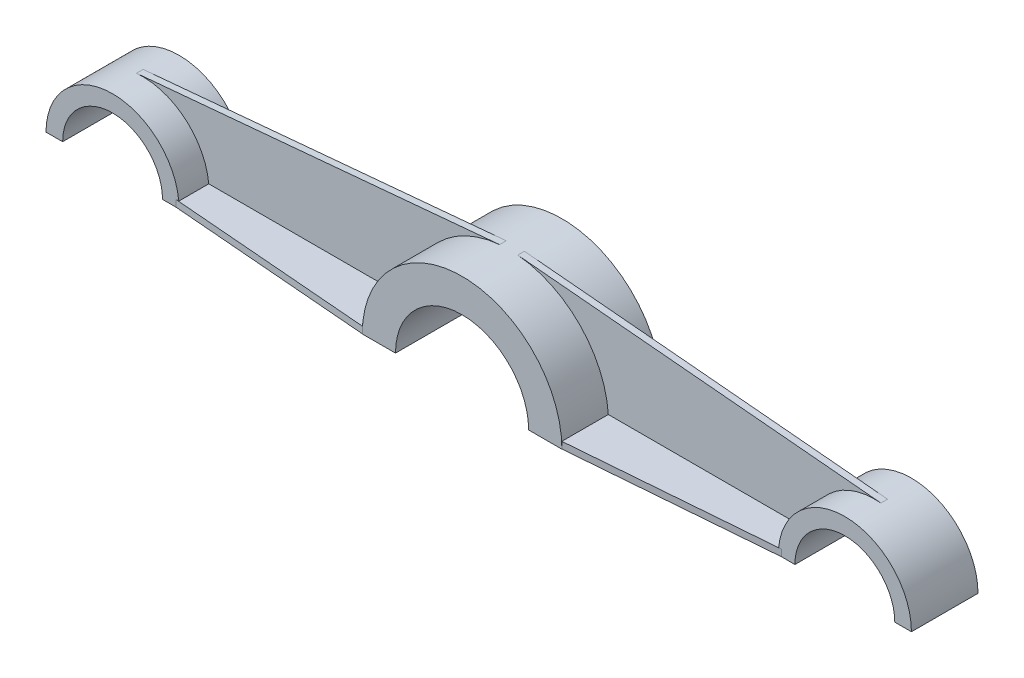
from build123d import *

# Parameters (mm, degrees)
BOSS_EXTRUDE1_DEPTH   = 15
BOSS_EXTRUDE2_DEPTH   = 10
BOSS_EXTRUDE2_2_DEPTH = 10
BOSS_EXTRUDE3_DEPTH   = 1
BOSS_EXTRUDE8_DEPTH   = 2


with BuildPart() as part:
    # Sketch1 → Boss-Extrude1 (new, symmetric)
    with BuildSketch(Plane.XY):
        with BuildLine():
            Line((-30, 0), (-20, 0))
            ThreePointArc((-20, 0), (0, 20), (20, 0))
            Line((20, 0), (30, 0))
            ThreePointArc((30, 0), (0, 30), (-30, 0))
        make_face()
    extrude(amount=BOSS_EXTRUDE1_DEPTH, both=True)



with BuildPart() as body_2:
    # Sketch1<3> → Boss-Extrude2 (new, symmetric)
    with BuildSketch(Plane.XY):
        with BuildLine():
            Line((-130, 0), (-125, 0))
            ThreePointArc((-125, 0), (-110, 15), (-95, 0))
            Line((-95, 0), (-90, 0))
            ThreePointArc((-90, 0), (-110, 20), (-130, 0))
        make_face()
    extrude(amount=BOSS_EXTRUDE2_DEPTH, both=True)


with BuildPart() as body_3:
    # Sketch1<3> → Boss-Extrude2 2 (new, symmetric)
    with BuildSketch(Plane.XY):
        with BuildLine():
            Line((90, 0), (95, 0))
            ThreePointArc((95, 0), (110, 15), (125, 0))
            Line((125, 0), (130, 0))
            ThreePointArc((130, 0), (110, 20), (90, 0))
        make_face()
    extrude(amount=BOSS_EXTRUDE2_2_DEPTH, both=True)


with BuildPart() as part_1:
    add(part.part)

    add(body_2.part)  # Boss-Extrude3 merges body 2

    add(body_3.part)  # Boss-Extrude3 merges body 3
    # Sketch2 → Boss-Extrude3 (add, symmetric)
    with BuildSketch(Plane.XY):
        with BuildLine():
            Line((-111.818181818, 19.917183909), (-2.727272727, 29.875775864))
            ThreePointArc((-2.727272727, 29.875775864), (-22.156468376, 20.225995874), (-30, 0))
            Line((-30, 0), (-90, 0))
            ThreePointArc((-90, 0), (-96.516002751, 14.770978918), (-111.818181818, 19.917183909))
        make_face()
        with BuildLine():
            Line((2.727272727, 29.875775864), (111.818181818, 19.917183909))
            ThreePointArc((111.818181818, 19.917183909), (96.516002751, 14.770978918), (90, 0))
            Line((90, 0), (30, 0))
            ThreePointArc((30, 0), (22.156468376, 20.225995874), (2.727272727, 29.875775864))
        make_face()
    extrude(amount=BOSS_EXTRUDE3_DEPTH, both=True)

    # Sketch3 → Boss-Extrude8 (add)
    with BuildSketch(Plane(origin=(0, 0, 0), x_dir=(1, 0, 0), z_dir=(0, 1, 0))):
        Polygon((91, 10), (91, -10), (29.5, -15), (29.5, 15), align=None)
        Polygon((-29.5, 15), (-29.5, -15), (-91, -10), (-91, 10), align=None)
    extrude(amount=BOSS_EXTRUDE8_DEPTH)


solid = part_1.part
